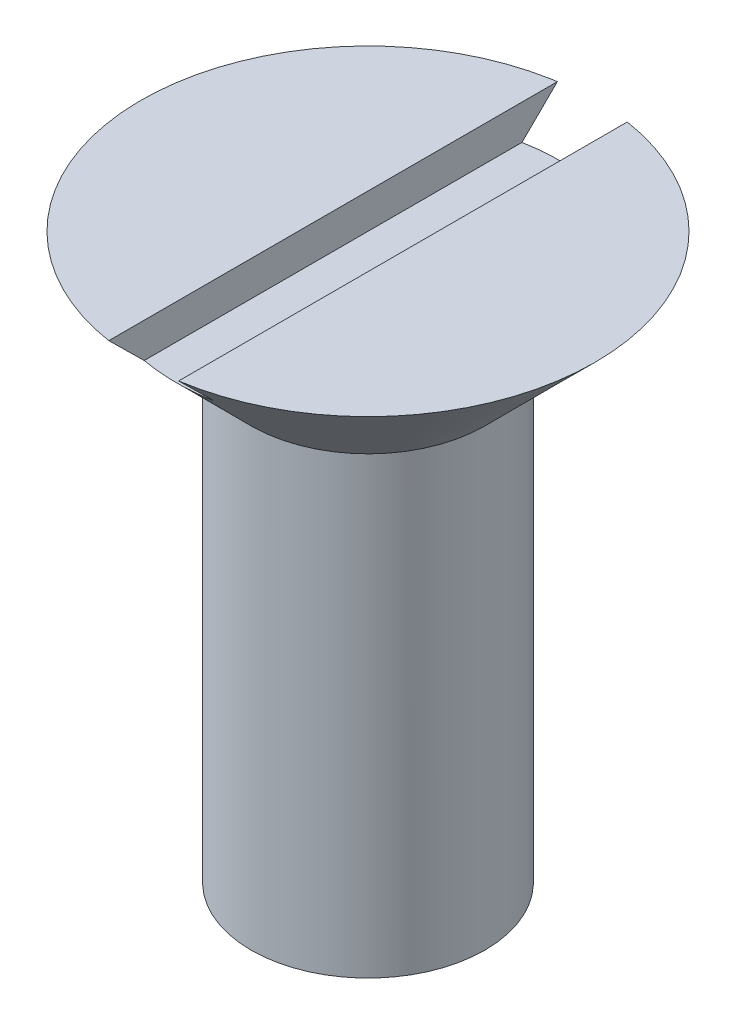
from build123d import *

# Parameters (mm, degrees)
CUT_EXTRUDE1_DEPTH      = 14.078020454
CUT_EXTRUDE1_DEPTH_BACK = 14.078020454
SKETCH3_W               = 2
SKETCH3_H               = 1


with BuildPart() as part:
    # Sketch1 → Revolve3 (revolve)
    with BuildSketch(Plane.XY, mode=Mode.PRIVATE) as revolve3_sk:
        Polygon((-3.348800718, -6.848800721), (0, -6.848800721), (0, 8.302398561), (-1, 8.302398561), (-1, 9.302398561), (-6.5, 9.302398561), (-3.348800718, 6.151199279), align=None)
    revolve(revolve3_sk.sketch.rotate(Axis((0, -6.848800721, 0), (0, 1, 0)), 180), axis=Axis((0, -6.848800721, 0), (0, 1, 0)))

    # Sketch3 → Cut-Extrude1 (cut, two sides: drawn at the far end of the back side and taken through both)
    with BuildSketch(Plane.XY.offset(-CUT_EXTRUDE1_DEPTH_BACK)):
        with Locations((0, 8.802398561)):
            Rectangle(SKETCH3_W, SKETCH3_H)
    extrude(amount=CUT_EXTRUDE1_DEPTH + CUT_EXTRUDE1_DEPTH_BACK, mode=Mode.SUBTRACT)

    # Sketch4 → Revolve4 (revolve)
    with BuildSketch(Plane(origin=(0, 0, 0), x_dir=(0, 0, -1), z_dir=(1, 0, 0)), mode=Mode.PRIVATE) as revolve4_sk:
        Polygon((-3.348800718, -6.848800721), (0, -8.782231717), (0, -6.848800721), align=None)
    revolve(revolve4_sk.sketch.rotate(Axis((0, -7.636657505, 0), (0, 1, 0)), 190.475681817), axis=Axis((0, -7.636657505, 0), (0, 1, 0)))


solid = part.part
